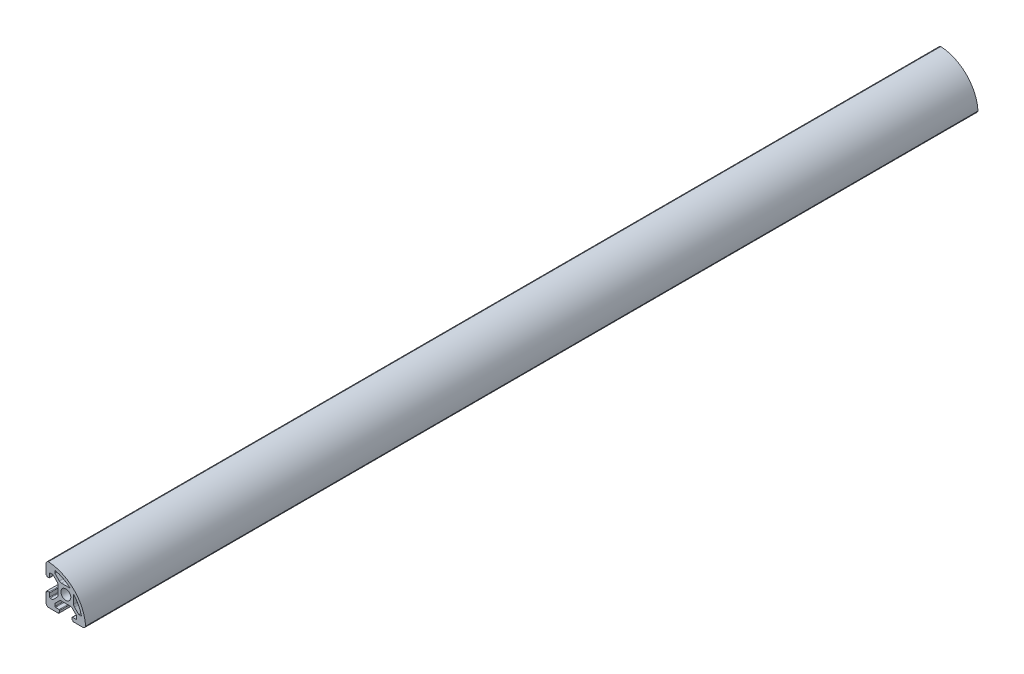
from build123d import *

# Parameters (mm, degrees)
SKETCH_1_R      = 2.5
EXTRUDE_1_DEPTH = 450


with BuildPart() as part:
    # 草图1 → 凸台-拉伸1 (new body)
    with BuildSketch(Plane.XY):
        with BuildLine():
            ThreePointArc((-8.944458369, 9.930115847), (-9.792033903, 9.405190523), (-10.123344197, 8.464890373))
            Line((-10.123344197, 8.464890373), (-10.123344197, 3.564890373))
            Line((-10.123344197, 3.564890373), (-9.823344197, 3.564890373))
            ThreePointArc((-9.823344197, 3.564890373), (-9.681922841, 3.50631173), (-9.623344197, 3.364890373))
            Line((-9.623344197, 3.364890373), (-9.623344197, 3.064890373))
            Line((-9.623344197, 3.064890373), (-8.623344197, 3.064890373))
            ThreePointArc((-8.623344197, 3.064890373), (-8.411212162, 3.152758339), (-8.323344197, 3.364890373))
            Line((-8.323344197, 3.364890373), (-8.323344197, 5.164890373))
            ThreePointArc((-8.323344197, 5.164890373), (-8.235476231, 5.377022408), (-8.023344197, 5.464890373))
            Line((-8.023344197, 5.464890373), (-6.683344197, 5.464890373))
            Line((-6.683344197, 5.464890373), (-4.462684025, 3.244230202))
            ThreePointArc((-4.462684025, 3.244230202), (-4.137524898, 2.757595178), (-4.023344197, 2.18357003))
            Line((-4.023344197, 2.18357003), (-4.023344197, -2.253789283))
            ThreePointArc((-4.023344197, -2.253789283), (-4.137524898, -2.827814432), (-4.462684025, -3.314449455))
            Line((-4.462684025, -3.314449455), (-6.683344197, -5.535109627))
            Line((-6.683344197, -5.535109627), (-8.023344197, -5.535109627))
            ThreePointArc((-8.023344197, -5.535109627), (-8.235476231, -5.447241661), (-8.323344197, -5.235109627))
            Line((-8.323344197, -5.235109627), (-8.323344197, -3.435109627))
            ThreePointArc((-8.323344197, -3.435109627), (-8.411212162, -3.222977592), (-8.623344197, -3.135109627))
            Line((-8.623344197, -3.135109627), (-9.623344197, -3.135109627))
            Line((-9.623344197, -3.135109627), (-9.623344197, -3.435109627))
            ThreePointArc((-9.623344197, -3.435109627), (-9.681922841, -3.576530983), (-9.823344197, -3.635109627))
            Line((-9.823344197, -3.635109627), (-10.123344197, -3.635109627))
            Line((-10.123344197, -3.635109627), (-10.123344197, -8.535109627))
            ThreePointArc((-10.123344197, -8.535109627), (-9.684004369, -9.595769798), (-8.623344197, -10.035109627))
            Line((-8.623344197, -10.035109627), (-3.723344197, -10.035109627))
            Line((-3.723344197, -10.035109627), (-3.723344197, -9.735109627))
            ThreePointArc((-3.723344197, -9.735109627), (-3.664765553, -9.59368827), (-3.523344197, -9.535109627))
            Line((-3.523344197, -9.535109627), (-3.223344197, -9.535109627))
            Line((-3.223344197, -9.535109627), (-3.223344197, -8.535109627))
            ThreePointArc((-3.223344197, -8.535109627), (-3.311212162, -8.322977592), (-3.523344197, -8.235109627))
            Line((-3.523344197, -8.235109627), (-5.323344197, -8.235109627))
            ThreePointArc((-5.323344197, -8.235109627), (-5.535476231, -8.147241661), (-5.623344197, -7.935109627))
            Line((-5.623344197, -7.935109627), (-5.623344197, -6.595109627))
            Line((-5.623344197, -6.595109627), (-3.402684025, -4.374449455))
            ThreePointArc((-3.402684025, -4.374449455), (-2.916049002, -4.049290328), (-2.342023853, -3.935109627))
            Line((-2.342023853, -3.935109627), (2.09533546, -3.935109627))
            ThreePointArc((2.09533546, -3.935109627), (2.669360608, -4.049290328), (3.155995631, -4.374449455))
            Line((3.155995631, -4.374449455), (5.376655803, -6.595109627))
            Line((5.376655803, -6.595109627), (5.376655803, -7.935109627))
            ThreePointArc((5.376655803, -7.935109627), (5.288787838, -8.147241661), (5.076655803, -8.235109627))
            Line((5.076655803, -8.235109627), (3.276655803, -8.235109627))
            ThreePointArc((3.276655803, -8.235109627), (3.064523769, -8.322977592), (2.976655803, -8.535109627))
            Line((2.976655803, -8.535109627), (2.976655803, -9.535109627))
            Line((2.976655803, -9.535109627), (3.276655803, -9.535109627))
            ThreePointArc((3.276655803, -9.535109627), (3.418077159, -9.59368827), (3.476655803, -9.735109627))
            Line((3.476655803, -9.735109627), (3.476655803, -10.035109627))
            Line((3.476655803, -10.035109627), (8.376655803, -10.035109627))
            ThreePointArc((8.376655803, -10.035109627), (9.316955952, -9.703799333), (9.841881277, -8.856223799))
            ThreePointArc((9.841881277, -8.856223799), (4.018791427, 4.107025997), (-8.944458369, 9.930115847))
        make_face()
        with BuildLine():
            ThreePointArc((7.820216628, -5.531930203), (7.798494154, -5.534313715), (7.776655803, -5.535109627))
            Line((7.776655803, -5.535109627), (6.436655803, -5.535109627))
            Line((6.436655803, -5.535109627), (4.215995631, -3.314449455))
            ThreePointArc((4.215995631, -3.314449455), (3.890836504, -2.827814432), (3.776655803, -2.253789283))
            Line((3.776655803, -2.253789283), (3.776655803, 2.173084343))
            ThreePointArc((3.776655803, 2.173084343), (6.257892136, -1.4383023), (7.820216628, -5.531930203))
        make_face(mode=Mode.SUBTRACT)
        with BuildLine():
            ThreePointArc((-5.620164773, 7.908451198), (-1.52653687, 6.346126706), (2.084849773, 3.864890373))
            Line((2.084849773, 3.864890373), (-2.342023853, 3.864890373))
            ThreePointArc((-2.342023853, 3.864890373), (-2.916049002, 3.979071075), (-3.402684025, 4.304230202))
            Line((-3.402684025, 4.304230202), (-5.623344197, 6.524890373))
            Line((-5.623344197, 6.524890373), (-5.623344197, 7.864890373))
            ThreePointArc((-5.623344197, 7.864890373), (-5.622548285, 7.886728724), (-5.620164773, 7.908451198))
        make_face(mode=Mode.SUBTRACT)
        with Locations((-0.123344197, -0.035109627)):
            Circle(SKETCH_1_R, mode=Mode.SUBTRACT)
    extrude(amount=EXTRUDE_1_DEPTH)


solid = part.part
